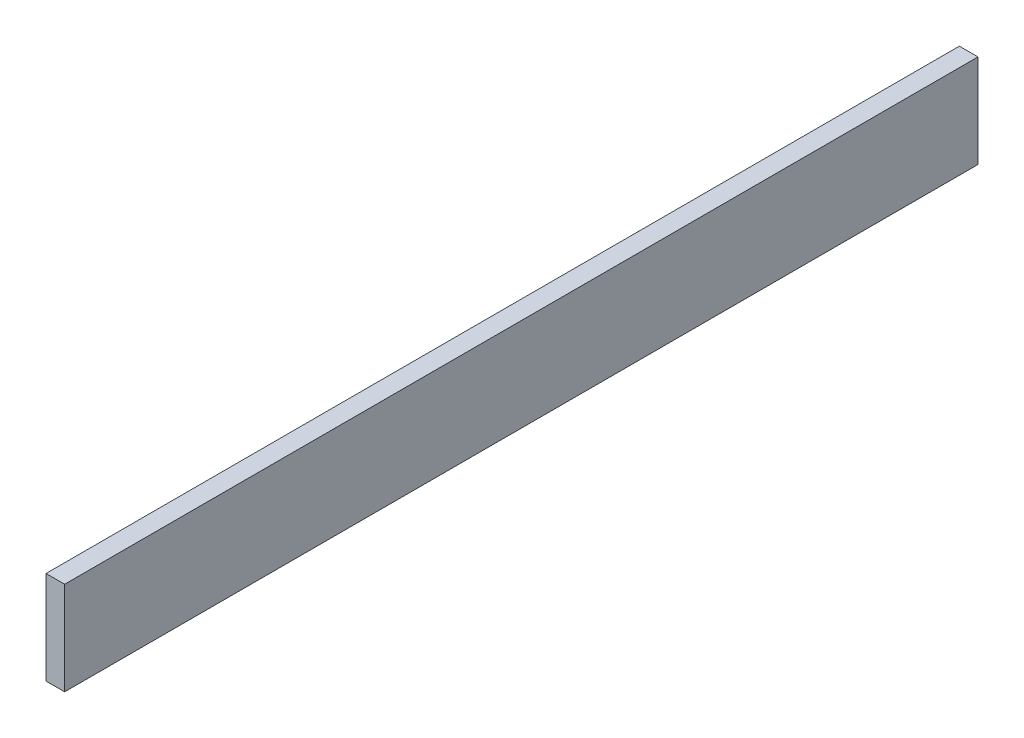
from build123d import *

# Parameters (mm, degrees)
SKETCH1_W           = 622.3
SKETCH1_H           = 63.5
BOSS_EXTRUDE1_DEPTH = 12.7


with BuildPart() as part:
    # Sketch1 → Boss-Extrude1 (new body)
    with BuildSketch(Plane(origin=(0, 0, 0), x_dir=(0, 0, -1), z_dir=(1, 0, 0))):
        with Locations((311.15, 31.75)):
            Rectangle(SKETCH1_W, SKETCH1_H)
    extrude(amount=BOSS_EXTRUDE1_DEPTH)


solid = part.part
